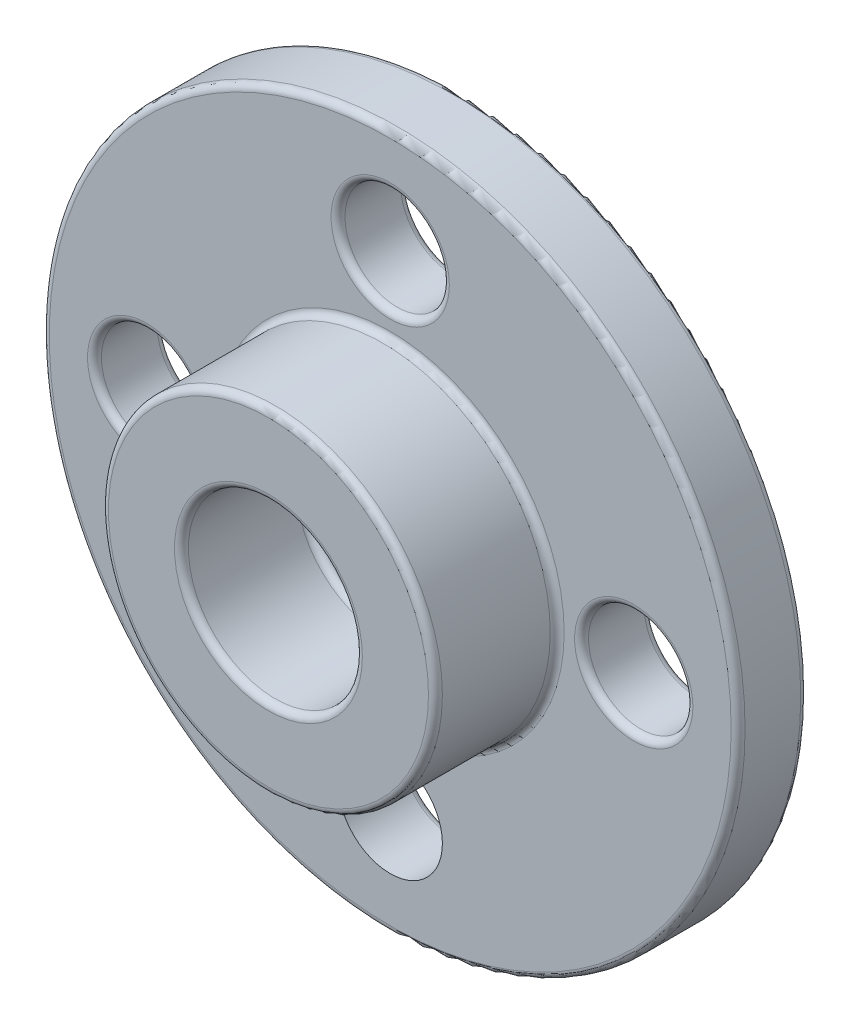
from build123d import *

# Parameters (mm, degrees)
SKETCH_2_R        = 10
SKETCH_2_R_2      = 1.5
SKETCH_2_R_3      = 4.8
EXTRUDE_1_DEPTH   = 2
SKETCH_2_R_4      = 2.5
SKETCH_2_R_5      = 1.65
EXTRUDE_1_2_DEPTH = 2
SKETCH_2_4_R      = 4.8
SKETCH_2_4_R_2    = 2.5
EXTRUDE_2_DEPTH   = 5.5
FILLET_1_R        = 0.2


with BuildPart() as part:
    # 草图2 → 凸台-拉伸1 (new body)
    with BuildSketch(Plane.XY):
        Circle(SKETCH_2_R)
        with Locations((-7, 0)):
            Circle(SKETCH_2_R_2, mode=Mode.SUBTRACT)
        with Locations((0, -7)):
            Circle(SKETCH_2_R_2, mode=Mode.SUBTRACT)
        Circle(SKETCH_2_R_3, mode=Mode.SUBTRACT)
        with Locations((7, 0)):
            Circle(SKETCH_2_R_2, mode=Mode.SUBTRACT)
        with Locations((0, 7)):
            Circle(SKETCH_2_R_2, mode=Mode.SUBTRACT)
    extrude(amount=EXTRUDE_1_DEPTH)



with BuildPart() as body_2:
    # 草图2 → Extrude 1 2 (new body)
    with BuildSketch(Plane.XY):
        Circle(SKETCH_2_R_4)
        Circle(SKETCH_2_R_5, mode=Mode.SUBTRACT)
    extrude(amount=EXTRUDE_1_2_DEPTH)


with BuildPart() as part_1:
    add(part.part)

    add(body_2.part)  # 凸台-拉伸2 merges body 2
    # 草图2<4> → 凸台-拉伸2 (add)
    with BuildSketch(Plane.XY):
        Circle(SKETCH_2_4_R)
        Circle(SKETCH_2_4_R_2, mode=Mode.SUBTRACT)
    extrude(amount=EXTRUDE_2_DEPTH)

    # 圆角1
    fillet_1_edges = [part_1.edges().sort_by_distance(p)[0] for p in [
        (5.5, 0, 2),
        (-8.5, 0, 2),
        (-1.5, 7, 2),
        (-10, 0, 2),
        (-4.8, 0, 2),
        (-1.65, 0, 2),
        (-2.5, 0, 2),
        (-2.5, 0, 5.5),
        (-8.5, 0, 0),
        (-1.5, 7, 0),
        (5.5, 0, 0),
        (-1.5, -7, 0),
        (-1.65, 0, 0),
        (-10, 0, 0),
        (-4.8, 0, 5.5),
    ]]
    fillet(fillet_1_edges, radius=FILLET_1_R)


solid = part_1.part
